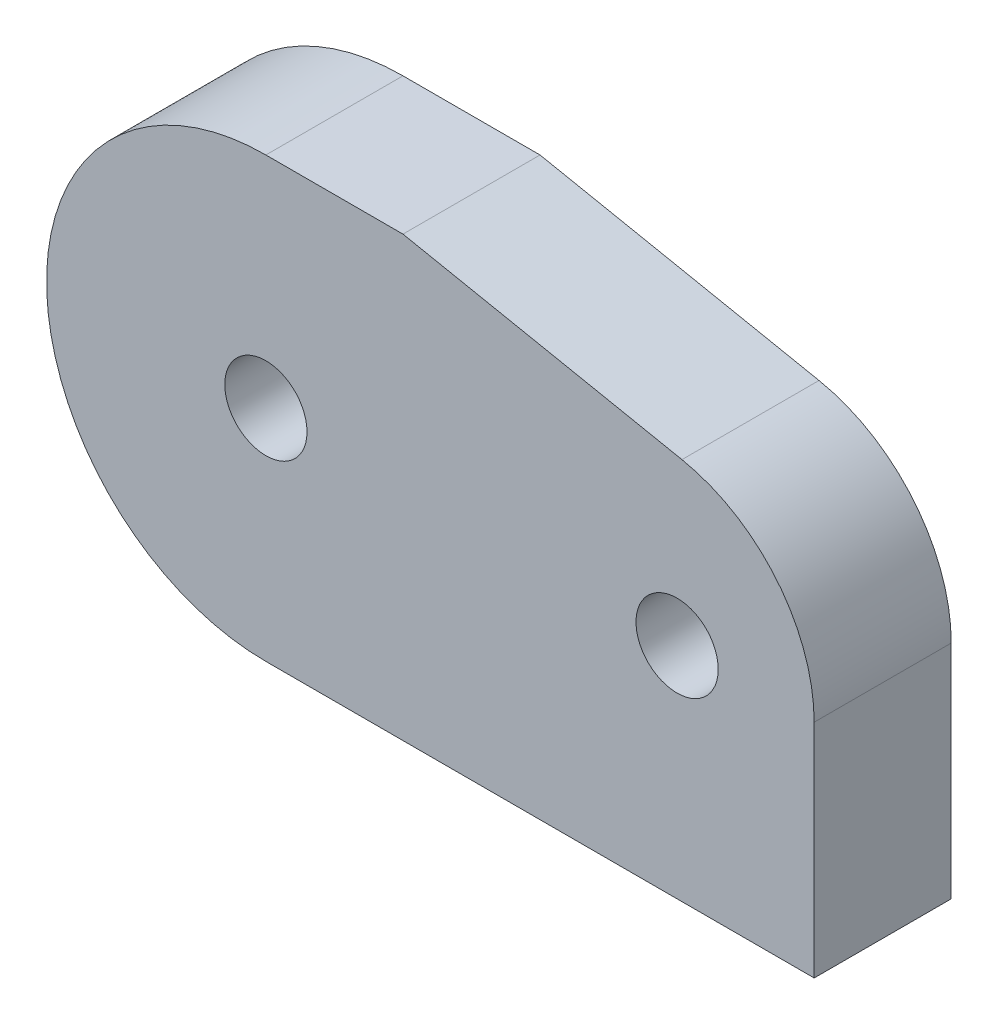
from build123d import *

# Parameters (mm, degrees)
ESQUISSE1_R        = 1.5
BOSS_EXTRU_1_DEPTH = 5
CONG_1_R           = 6


with BuildPart() as part:
    # Esquisse1 → Boss.-Extru.1 (new body)
    with BuildSketch(Plane.XY):
        with BuildLine():
            Line((0, 8), (5, 8))
            Line((5, 8), (20, 5))
            Line((20, 5), (20, -8))
            Line((20, -8), (0, -8))
            ThreePointArc((0, -8), (-8, 0), (0, 8))
        make_face()
        Circle(ESQUISSE1_R, mode=Mode.SUBTRACT)
        with Locations((15, 0)):
            Circle(ESQUISSE1_R, mode=Mode.SUBTRACT)
    extrude(amount=BOSS_EXTRU_1_DEPTH)

    # Congé1
    cong_1_edges = [part.edges().sort_by_distance(p)[0] for p in [
        (20, 5, 2.5),
    ]]
    fillet(cong_1_edges, radius=CONG_1_R)


solid = part.part
